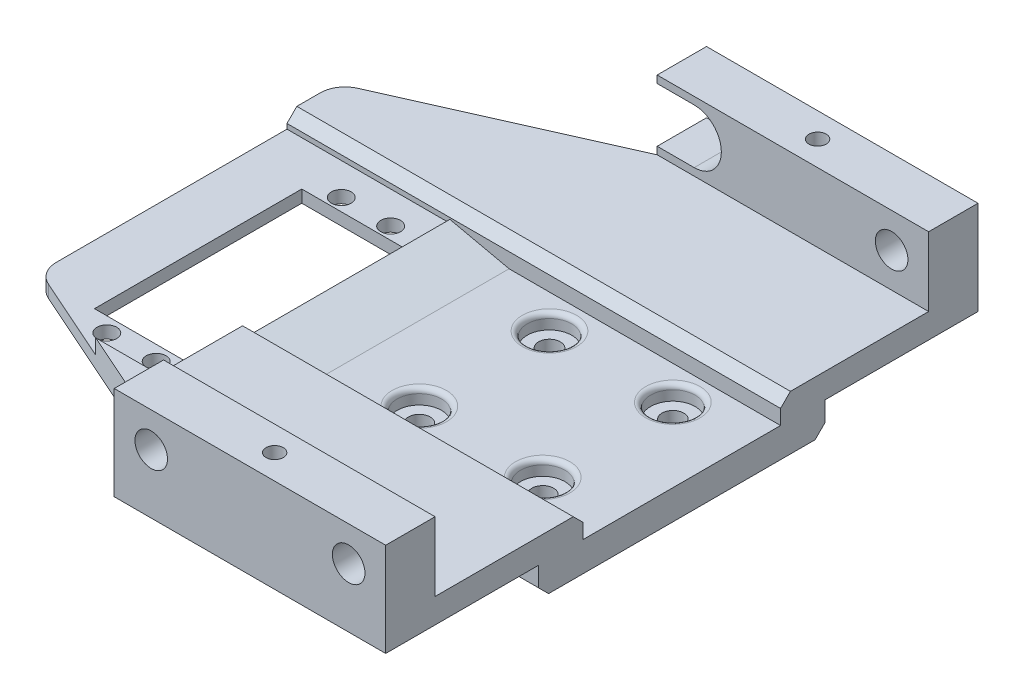
from build123d import *

# Parameters (mm, degrees)
CROQUIS1_W                        = 55
CROQUIS1_H                        = 58
CROQUIS1_R                        = 2.2
SALIENTE_EXTRUIR1_DEPTH           = 6
CROQUIS2_R                        = 4.5
CORTAR_EXTRUIR1_DEPTH             = 3
REDONDEO1_R                       = 1
CROQUIS3_W                        = 55
CROQUIS3_H                        = 40
SALIENTE_EXTRUIR2_DEPTH           = 5
CROQUIS4_W                        = 55
CROQUIS4_H                        = 10
SALIENTE_EXTRUIR3_DEPTH           = 14
CORTAR_EXTRUIR2_DEPTH             = 71.577971067
CORTAR_EXTRUIR2_DEPTH_BACK        = 71.577971067
CROQUIS5_R                        = 3.3
CORTAR_EXTRUIR3_REACH             = 127.623
SALIENTE_EXTRUIR4_REACH           = 69.47
CORTAR_EXTRUIR4_DEPTH             = 118.48297749
CORTAR_EXTRUIR5_REACH             = 99.372
CORTAR_EXTRUIR5_DIRECTION_2_REACH = 99.372
CROQUIS10_W                       = 21
CROQUIS10_H                       = 42
CORTAR_EXTRUIR6_DEPTH             = 98.371710471
CROQUIS11_W                       = 33
CROQUIS11_H                       = 63.666666667
CORTAR_EXTRUIR7_DEPTH             = 5.5
CROQUIS12_R                       = 2
CORTAR_EXTRUIR8_DEPTH             = 97.106711524
CORTAR_EXTRUIR9_DEPTH             = 3
CHAFL_N1_SIZE                     = 2
CROQUIS14_R                       = 1.75
CORTAR_EXTRUIR10_DEPTH            = 98.371710471
CORTAR_EXTRUIR11_DEPTH            = 2.5
REDONDEO2_R                       = 5


with BuildPart() as part:
    # Croquis1 → Saliente-Extruir1 (new body)
    with BuildSketch(Plane(origin=(0, 0, 0), x_dir=(1, 0, 0), z_dir=(0, 1, 0))):
        Rectangle(CROQUIS1_W, CROQUIS1_H)
        with Locations(Location((-12.5, 13.181818182, 0), (0, 0, 270))):
            Circle(CROQUIS1_R, mode=Mode.SUBTRACT)
        with Locations(Location((12.5, 13.181818182, 0), (0, 0, 270))):
            Circle(CROQUIS1_R, mode=Mode.SUBTRACT)
        with Locations(Location((-12.5, -13.181818182, 0), (0, 0, 270))):
            Circle(CROQUIS1_R, mode=Mode.SUBTRACT)
        with Locations(Location((12.5, -13.181818182, 0), (0, 0, 270))):
            Circle(CROQUIS1_R, mode=Mode.SUBTRACT)
    extrude(amount=SALIENTE_EXTRUIR1_DEPTH)

    # Croquis2 → Cortar-Extruir1 (cut)
    with BuildSketch(Plane(origin=(0, 6, 0), x_dir=(1, 0, 0), z_dir=(0, 1, 0))):
        with Locations(Location((-12.5, 13.181818182, 0), (0, 0, 270))):
            Circle(CROQUIS2_R)
        with Locations(Location((12.5, 13.181818182, 0), (0, 0, 270))):
            Circle(CROQUIS2_R)
        with Locations(Location((-12.5, -13.181818182, 0), (0, 0, 270))):
            Circle(CROQUIS2_R)
        with Locations(Location((12.5, -13.181818182, 0), (0, 0, 270))):
            Circle(CROQUIS2_R)
    extrude(amount=-CORTAR_EXTRUIR1_DEPTH, mode=Mode.SUBTRACT)

    # Redondeo1
    redondeo1_edges = [part.edges().sort_by_distance(p)[0] for p in [
        (12.5, 6, -17.681818182),
        (-12.5, 6, 8.681818182),
        (12.5, 6, 8.681818182),
        (-12.5, 6, -17.681818182),
    ]]
    fillet(redondeo1_edges, radius=REDONDEO1_R)

    # Croquis3 → Saliente-Extruir2 (add)
    with BuildSketch(Plane(origin=(0, 6, 0), x_dir=(1, 0, 0), z_dir=(0, 1, 0))):
        with Locations((0, 40)):
            Rectangle(CROQUIS3_W, CROQUIS3_H)
        with Locations((0, -40)):
            Rectangle(CROQUIS3_W, CROQUIS3_H)
    extrude(amount=SALIENTE_EXTRUIR2_DEPTH)

    # Croquis4 → Saliente-Extruir3 (add)
    with BuildSketch(Plane(origin=(0, 11, 0), x_dir=(1, 0, 0), z_dir=(0, 1, 0))):
        with Locations((0, 55)):
            Rectangle(CROQUIS4_W, CROQUIS4_H)
        with Locations((0, -55)):
            Rectangle(CROQUIS4_W, CROQUIS4_H)
    extrude(amount=SALIENTE_EXTRUIR3_DEPTH)

    # Croquis5 → Cortar-Extruir2 (cut, two sides: drawn at the far end of the back side and taken through both)
    with BuildSketch(Plane.XY.offset(-CORTAR_EXTRUIR2_DEPTH_BACK)):
        with Locations((-20, 18)):
            Circle(CROQUIS5_R)
        with Locations((20, 18)):
            Circle(CROQUIS5_R)
    extrude(amount=CORTAR_EXTRUIR2_DEPTH + CORTAR_EXTRUIR2_DEPTH_BACK, mode=Mode.SUBTRACT)

    # Croquis6 → Cortar-Extruir3 (cut, up to next)
    with BuildSketch(Plane(origin=(0, 0, -60), x_dir=(-1, 0, 0), z_dir=(0, 0, -1)), mode=Mode.PRIVATE) as cortar_extruir3_sk1:
        with BuildLine():
            Line((27.5, 23.5), (20, 23.5))
            ThreePointArc((20, 23.5), (14.5, 18), (20, 12.5))
            Line((20, 12.5), (27.5, 12.5))
            Line((27.5, 12.5), (27.5, 23.5))
        make_face()
    cortar_extruir3_tool1 = extrude(cortar_extruir3_sk1.sketch, amount=-CORTAR_EXTRUIR3_REACH, mode=Mode.PRIVATE) & part.part
    add(cortar_extruir3_tool1.solids().sort_by_distance((-21.526408, 18, -60))[0], mode=Mode.SUBTRACT)

    # Saliente-Extruir4: up to this face of the body (flat: up to its plane)
    saliente_extruir4_end = Plane(part.part.faces().sort_by_distance((0, 0, 0))[0])
    # Croquis7 → Saliente-Extruir4 (add, up to the picked face)
    with BuildSketch(Plane(origin=(0, 11, 0), x_dir=(1, 0, 0), z_dir=(0, 1, 0)), mode=Mode.PRIVATE) as saliente_extruir4_sk1:
        Polygon((-72.5, 30), (-72.5, -30), (-27.5, -50), (-27.5, 50), align=None)
    saliente_extruir4_tool1 = split(extrude(saliente_extruir4_sk1.sketch, amount=-SALIENTE_EXTRUIR4_REACH, mode=Mode.PRIVATE), bisect_by=saliente_extruir4_end, keep=Keep.BOTH, mode=Mode.PRIVATE)
    add(saliente_extruir4_tool1.solids().sort_by(Axis((-48.125, 11, 0), (0, -1, 0)))[0])

    # Croquis8 → Cortar-Extruir4 (cut, through all)
    with BuildSketch(Plane(origin=(0, 0, -29), x_dir=(-1, 0, 0), z_dir=(0, 0, -1))):
        Polygon((27.5, 6), (47.5, 0), (27.5, 0), align=None)
    cortar_extruir4 = extrude(amount=CORTAR_EXTRUIR4_DEPTH, mode=Mode.SUBTRACT)

    # Simetría1: Cortar-Extruir4 across plane
    add(cortar_extruir4.mirror(Plane.XY), mode=Mode.SUBTRACT)

    # Cortar-Extruir5: up to this face of the body (flat: up to its plane)
    cortar_extruir5_end = Plane(part.part.faces().sort_by_distance((0, 8.5, -20))[0])
    # Croquis9 → Cortar-Extruir5 (cut, up to the picked face)
    with BuildSketch(Plane.XY, mode=Mode.PRIVATE) as cortar_extruir5_sk1:
        Polygon((-27.5, 6), (-50, 11), (-27.5, 11), align=None)
    cortar_extruir5_tool1 = split(extrude(cortar_extruir5_sk1.sketch, amount=-CORTAR_EXTRUIR5_REACH, mode=Mode.PRIVATE), bisect_by=cortar_extruir5_end, keep=Keep.BOTH, mode=Mode.PRIVATE)
    add(cortar_extruir5_tool1.solids().sort_by(Axis((-35, 9.333333, 0), (0, 0, -1)))[0], mode=Mode.SUBTRACT)

    # Cortar-Extruir5 direction 2: up to this face of the body (flat: up to its plane)
    cortar_extruir5_direction_2_end = Plane(part.part.faces().sort_by_distance((0, 8.5, 20))[0])
    # Croquis9 → Cortar-Extruir5 direction 2 (cut, up to the picked face)
    with BuildSketch(Plane.XY, mode=Mode.PRIVATE) as cortar_extruir5_direction_2_sk1:
        Polygon((-27.5, 6), (-50, 11), (-27.5, 11), align=None)
    cortar_extruir5_direction_2_tool1 = split(extrude(cortar_extruir5_direction_2_sk1.sketch, amount=CORTAR_EXTRUIR5_DIRECTION_2_REACH, mode=Mode.PRIVATE), bisect_by=cortar_extruir5_direction_2_end, keep=Keep.BOTH, mode=Mode.PRIVATE)
    add(cortar_extruir5_direction_2_tool1.solids().sort_by(Axis((-35, 9.333333, 0), (0, 0, 1)))[0], mode=Mode.SUBTRACT)

    # Croquis10 → Cortar-Extruir6 (cut, through all)
    with BuildSketch(Plane.XZ):
        with Locations((-50, 10)):
            Rectangle(CROQUIS10_W, CROQUIS10_H)
    extrude(amount=-CORTAR_EXTRUIR6_DEPTH, mode=Mode.SUBTRACT)

    # Croquis11 → Cortar-Extruir7 (cut)
    with BuildSketch(Plane.XZ):
        with Locations((-56, 12.833333334)):
            Rectangle(CROQUIS11_W, CROQUIS11_H)
    extrude(amount=-CORTAR_EXTRUIR7_DEPTH, mode=Mode.SUBTRACT)

    # Croquis12 → Cortar-Extruir8 (cut, through all)
    with BuildSketch(Plane.XZ.offset(-5.5)):
        with Locations(Location((-45, 34, 0), (0, 0, 270))):
            Circle(CROQUIS12_R)
        with Locations(Location((-55, 34, 0), (0, 0, 270))):
            Circle(CROQUIS12_R)
        with Locations(Location((-55, -13.5, 0), (0, 0, 270))):
            Circle(CROQUIS12_R)
        with Locations((-45, -13.5)):
            Circle(CROQUIS12_R)
    extrude(amount=-CORTAR_EXTRUIR8_DEPTH, mode=Mode.SUBTRACT)

    # Croquis13 → Cortar-Extruir9 (cut)
    with BuildSketch(Plane(origin=(0, 11, 0), x_dir=(1, 0, 0), z_dir=(0, 1, 0))):
        Polygon((-72.5, 20), (-39.5, 20), (-39.5, -39), (-52.25, -39), (-72.5, -30), align=None)
    extrude(amount=-CORTAR_EXTRUIR9_DEPTH, mode=Mode.SUBTRACT)

    # Chaflán1
    chafl_n1_edges = [part.edges().sort_by_distance(p)[0] for p in [
        (-6, 0, 29),
        (-56, 0, -19),
        (-10, 0, -29),
        (-22.5, 11, -20),
        (-6, 11, 20),
    ]]
    chamfer(chafl_n1_edges, length=CHAFL_N1_SIZE)

    # Croquis14 → Cortar-Extruir10 (cut, through all)
    with BuildSketch(Plane(origin=(0, 25, 0), x_dir=(1, 0, 0), z_dir=(0, 1, 0))):
        with Locations(Location((0, 55, 0), (0, 0, 270))):
            Circle(CROQUIS14_R)
        with Locations(Location((0, -55, 0), (0, 0, 270))):
            Circle(CROQUIS14_R)
    extrude(amount=-CORTAR_EXTRUIR10_DEPTH, mode=Mode.SUBTRACT)

    # Croquis15 → Cortar-Extruir11 (cut)
    with BuildSketch(Plane.XZ.offset(-6)):
        Polygon((3.810511777, 55), (1.905255888, 58.3), (-1.905255888, 58.3), (-3.810511777, 55), (-1.905255888, 51.7), (1.905255888, 51.7), align=None)
        Polygon((1.905255888, -51.7), (3.810511777, -55), (1.905255888, -58.3), (-1.905255888, -58.3), (-3.810511777, -55), (-1.905255888, -51.7), align=None)
    extrude(amount=-CORTAR_EXTRUIR11_DEPTH, mode=Mode.SUBTRACT)

    # Redondeo2
    redondeo2_edges = [part.edges().sort_by_distance(p)[0] for p in [
        (-72.5, 5.5, -30),
        (-72.5, 6.75, 30),
    ]]
    fillet(redondeo2_edges, radius=REDONDEO2_R)


solid = part.part
